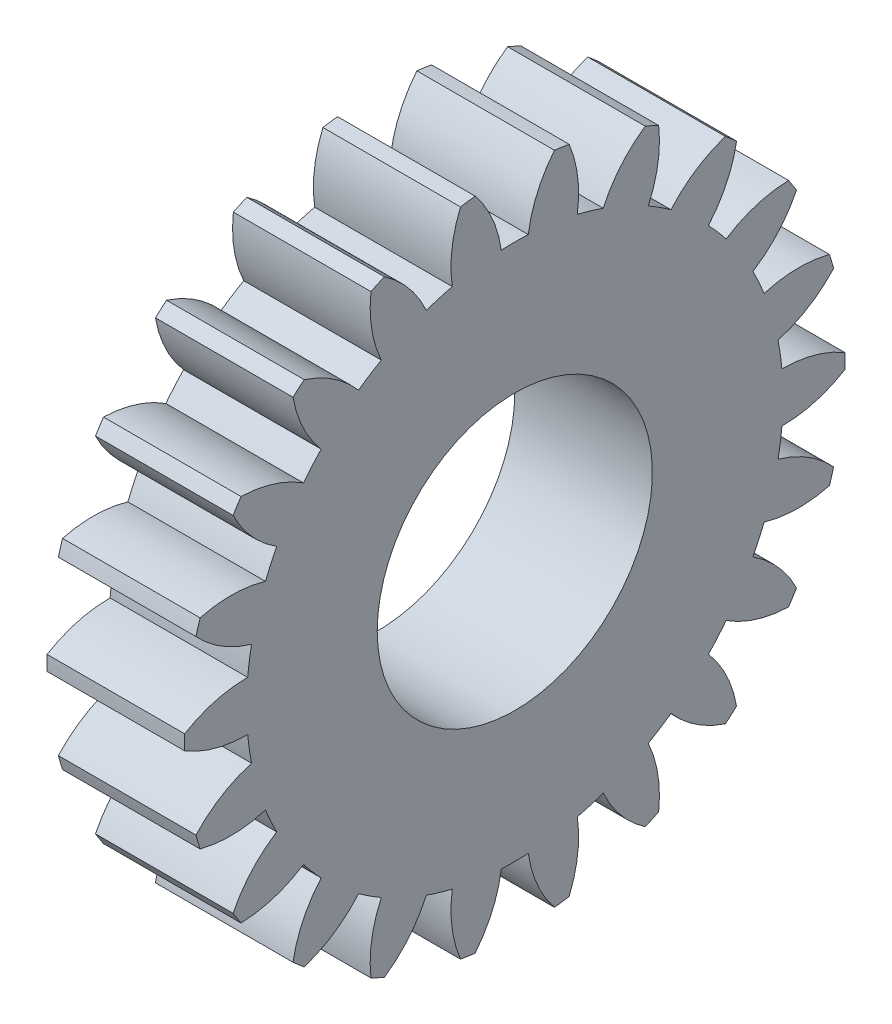
from build123d import *

# Parameters (mm, degrees)
BASPROSKE_W     = 2.5
BASPROSKE_H     = 6
TOOTHCUT_DEPTH  = 9.845903006
TEETHCUTS_COUNT = 22
TEETHCUTS_ANGLE = 343.636363636
BORSKE_R        = 2.5
BORE_DEPTH      = 50.0000508


with BuildPart() as part:
    # BasProSke → Base-Revolve (revolve)
    with BuildSketch(Plane(origin=(0, 0, 0), x_dir=(1, 0, 0), z_dir=(0, 1, 0)), mode=Mode.PRIVATE) as base_revolve_sk:
        with Locations((1.25, 3)):
            Rectangle(BASPROSKE_W, BASPROSKE_H)
    revolve(base_revolve_sk.sketch.rotate(Axis((-10, 0, 0), (1, 0, 0)), 180), axis=Axis((-10, 0, 0), (1, 0, 0)))

    # TooCutSke → ToothCut (cut, through all)
    with BuildSketch(Plane(origin=(0, 0, 0), x_dir=(0, 0, -1), z_dir=(1, 0, 0))):
        with BuildLine():
            ThreePointArc((0.245431665, 4.867816687), (0, 4.874), (-0.245431665, 4.867816687))
            ThreePointArc((-0.245431665, 4.867816687), (-0.414371147, 5.458682637), (-0.740152859, 5.979767462))
            ThreePointArc((-0.740152859, 5.979767462), (0, 6.0254), (0.740152859, 5.979767462))
            ThreePointArc((0.740152859, 5.979767462), (0.414371147, 5.458682637), (0.245431665, 4.867816687))
        make_face()
    toothcut = extrude(amount=TOOTHCUT_DEPTH, mode=Mode.SUBTRACT)

    # TeethCuts: ToothCut ×22 about axis
    teethcuts_axis = Axis((-10, 0, 0), (1, 0, 0))
    for i in range(1, TEETHCUTS_COUNT):
        add(toothcut.rotate(teethcuts_axis, i * TEETHCUTS_ANGLE / (TEETHCUTS_COUNT - 1)), mode=Mode.SUBTRACT)

    # BorSke → Bore (cut, symmetric)
    with BuildSketch(Plane(origin=(0, 0, 0), x_dir=(0, 0, -1), z_dir=(1, 0, 0))):
        with Locations(Location((0, 0, 0), (0, 0, 180))):
            Circle(BORSKE_R)
    extrude(amount=BORE_DEPTH, both=True, mode=Mode.SUBTRACT)


solid = part.part
